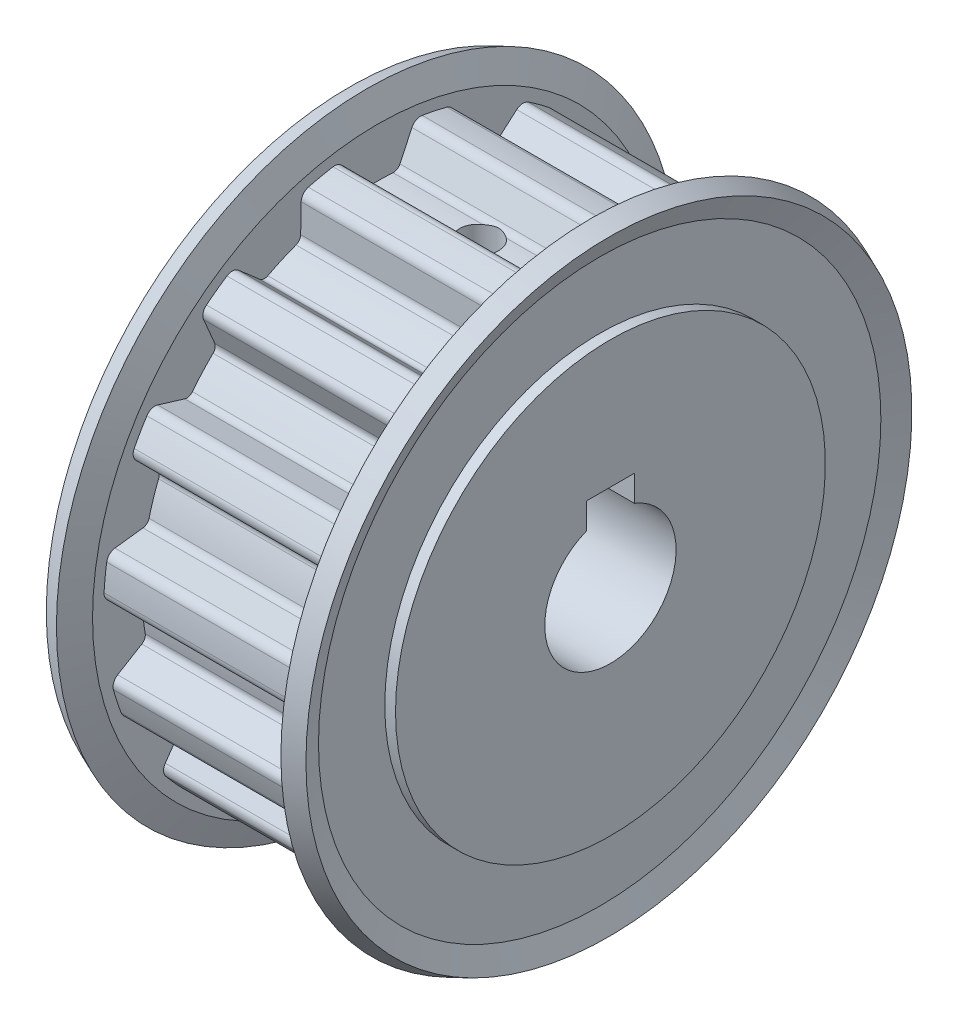
from build123d import *

# Parameters (mm, degrees)
SKETCH2_W           = 15
SKETCH2_H           = 18
CUT_EXTRUDE1_DEPTH  = 17
CUT_EXTRUDE2_DEPTH  = 17
CUT_EXTRUDE3_DEPTH  = 17
CUT_EXTRUDE4_DEPTH  = 17
CUT_EXTRUDE5_DEPTH  = 17
CUT_EXTRUDE6_DEPTH  = 17
CUT_EXTRUDE7_DEPTH  = 17
CUT_EXTRUDE8_DEPTH  = 17
CUT_EXTRUDE9_DEPTH  = 17
CUT_EXTRUDE10_DEPTH = 17
CUT_EXTRUDE11_DEPTH = 17
CUT_EXTRUDE12_DEPTH = 17
CUT_EXTRUDE13_DEPTH = 17
CUT_EXTRUDE14_DEPTH = 17
CUT_EXTRUDE15_DEPTH = 17
SKETCH18_W          = 1.621
SKETCH18_H          = 15.65
SKETCH20_W          = 4
SKETCH20_H          = 7.3
CUT_EXTRUDE16_DEPTH = 37


with BuildPart() as part:
    # Sketch1 → Revolve1 (revolve)
    with BuildSketch(Plane.XY, mode=Mode.PRIVATE) as revolve1_sk:
        Polygon((0, 18), (0, 5.5), (37, 5.5), (37, 6.5), (22, 6.5), (22, 18), (21.1, 18), (21.1, 23.550143875), (21.873308267, 25.376010616), (20.4, 26), (19.5, 23.875), (19.5, 22.95), (2.5, 22.95), (2.5, 23.875), (1.6, 26), (0.126691733, 25.376010616), (0.9, 23.550143875), (0.9, 18), align=None)
    revolve(revolve1_sk.sketch.rotate(Axis((37, 0, 0), (-1, 0, 0)), 270), axis=Axis((37, 0, 0), (-1, 0, 0)))

    # Sketch2 → Cut-Revolve1 (revolve, cut)
    with BuildSketch(Plane.XY, mode=Mode.PRIVATE) as cut_revolve1_sk:
        with Locations((29.5, 9)):
            Rectangle(SKETCH2_W, SKETCH2_H)
    revolve(cut_revolve1_sk.sketch.rotate(Axis((37, 0, 0), (-1, 0, 0)), 270), axis=Axis((37, 0, 0), (-1, 0, 0)), mode=Mode.SUBTRACT)

    # Sketch3 → Cut-Extrude1 (cut)
    with BuildSketch(Plane(origin=(2.5, 0, 0), x_dir=(0, 0, -1), z_dir=(1, 0, 0))):
        with BuildLine():
            Line((-2.873736897, 22.193786317), (-1.875385892, 20.052815678))
            ThreePointArc((-1.875385892, 20.052815678), (-1.63724315, 19.790069862), (-1.292340251, 19.707672533))
            ThreePointArc((-1.292340251, 19.707672533), (0, 19.75), (1.292340251, 19.707672533))
            ThreePointArc((1.292340251, 19.707672533), (1.63724315, 19.790069862), (1.875385892, 20.052815678))
            Line((1.875385892, 20.052815678), (2.873736897, 22.193786317))
            ThreePointArc((2.873736897, 22.193786317), (3.225368058, 22.563195196), (3.72876175, 22.645062062))
            Line((3.72876175, 22.645062062), (3.72876175, 30.6))
            Line((3.72876175, 30.6), (-3.72876175, 30.6))
            Line((-3.72876175, 30.6), (-3.72876175, 22.645062062))
            ThreePointArc((-3.72876175, 22.645062062), (-3.225368058, 22.563195196), (-2.873736897, 22.193786317))
        make_face()
    extrude(amount=CUT_EXTRUDE1_DEPTH, mode=Mode.SUBTRACT)

    # Sketch4 → Cut-Extrude2 (cut)
    with BuildSketch(Plane(origin=(2.5, 0, 0), x_dir=(0, 0, -1), z_dir=(1, 0, 0))):
        with BuildLine():
            Line((6.401736855, 21.443886776), (6.44296467, 19.081946838))
            ThreePointArc((6.44296467, 19.081946838), (6.553650539, 18.745055212), (6.835221003, 18.529496859))
            ThreePointArc((6.835221003, 18.529496859), (8.033048701, 18.042522788), (9.196444135, 17.478212588))
            ThreePointArc((9.196444135, 17.478212588), (9.545042625, 17.413201646), (9.869465197, 17.556370514))
            Line((9.869465197, 17.556370514), (11.652315432, 19.106178579))
            ThreePointArc((11.652315432, 19.106178579), (12.123798609, 19.300629105), (12.616969885, 19.170669548))
            Line((12.616969885, 19.170669548), (15.852534637, 26.437866967))
            Line((15.852534637, 26.437866967), (9.039747919, 29.471115041))
            Line((9.039747919, 29.471115041), (5.804183166, 22.203917622))
            ThreePointArc((5.804183166, 22.203917622), (6.230757933, 21.924379858), (6.401736855, 21.443886776))
        make_face()
    extrude(amount=CUT_EXTRUDE2_DEPTH, mode=Mode.SUBTRACT)

    # Sketch5 → Cut-Extrude3 (cut)
    with BuildSketch(Plane(origin=(2.5, 0, 0), x_dir=(0, 0, -1), z_dir=(1, 0, 0))):
        with BuildLine():
            Line((14.570292147, 16.9861444), (13.647268108, 14.811636036))
            ThreePointArc((13.647268108, 14.811636036), (13.611358512, 14.458850222), (13.78091045, 14.147402842))
            ThreePointArc((13.78091045, 14.147402842), (14.677110303, 13.215329476), (15.510399281, 12.226610902))
            ThreePointArc((15.510399281, 12.226610902), (15.802417515, 12.025432672), (16.157024307, 12.024269392))
            Line((16.157024307, 12.024269392), (18.416102771, 12.714938991))
            ThreePointArc((18.416102771, 12.714938991), (18.92591424, 12.700808901), (19.323589305, 12.381494109))
            Line((19.323589305, 12.381494109), (25.23526027, 17.704386555))
            Line((25.23526027, 17.704386555), (20.245203049, 23.246406554))
            Line((20.245203049, 23.246406554), (14.333532084, 17.923514109))
            ThreePointArc((14.333532084, 17.923514109), (14.609529272, 17.494640065), (14.570292147, 16.9861444))
        make_face()
    extrude(amount=CUT_EXTRUDE3_DEPTH, mode=Mode.SUBTRACT)

    # Sketch6 → Cut-Extrude4 (cut)
    with BuildSketch(Plane(origin=(2.5, 0, 0), x_dir=(0, 0, -1), z_dir=(1, 0, 0))):
        with BuildLine():
            Line((20.219511559, 9.591343343), (18.491834909, 7.980258803))
            ThreePointArc((18.491834909, 7.980258803), (18.315538943, 7.672578674), (18.343755284, 7.319094349))
            ThreePointArc((18.343755284, 7.319094349), (18.783366197, 6.103085639), (19.142465484, 4.860917116))
            ThreePointArc((19.142465484, 4.860917116), (19.327410857, 4.558357141), (19.650887133, 4.413062856))
            Line((19.650887133, 4.413062856), (21.995578636, 4.125170939))
            ThreePointArc((21.995578636, 4.125170939), (22.455567362, 3.904903454), (22.688984585, 3.451445856))
            Line((22.688984585, 3.451445856), (30.254580147, 5.909656868))
            Line((30.254580147, 5.909656868), (27.95007865, 13.002183188))
            Line((27.95007865, 13.002183188), (20.384483088, 10.543972176))
            ThreePointArc((20.384483088, 10.543972176), (20.462180277, 10.039918072), (20.219511559, 9.591343343))
        make_face()
    extrude(amount=CUT_EXTRUDE4_DEPTH, mode=Mode.SUBTRACT)

    # Sketch7 → Cut-Extrude5 (cut)
    with BuildSketch(Plane(origin=(2.5, 0, 0), x_dir=(0, 0, -1), z_dir=(1, 0, 0))):
        with BuildLine():
            Line((22.372593735, 0.538111888), (20.138995461, -0.230977675))
            ThreePointArc((20.138995461, -0.230977675), (19.852796299, -0.44035143), (19.734798181, -0.774752049))
            ThreePointArc((19.734798181, -0.774752049), (19.641807434, -2.06443715), (19.464625501, -3.3452734))
            ThreePointArc((19.464625501, -3.3452734), (19.510519278, -3.696899751), (19.746933051, -3.961202339))
            Line((19.746933051, -3.961202339), (21.771819131, -5.177876643))
            ThreePointArc((21.771819131, -5.177876643), (22.102448885, -5.566195274), (22.131248308, -6.075388741))
            Line((22.131248308, -6.075388741), (30.042608263, -6.906906179))
            Line((30.042608263, -6.906906179), (30.822131734, 0.509764227))
            Line((30.822131734, 0.509764227), (22.910771779, 1.341281665))
            ThreePointArc((22.910771779, 1.341281665), (22.776734418, 0.849203034), (22.372593735, 0.538111888))
        make_face()
    extrude(amount=CUT_EXTRUDE5_DEPTH, mode=Mode.SUBTRACT)

    # Sketch8 → Cut-Extrude6 (cut)
    with BuildSketch(Plane(origin=(2.5, 0, 0), x_dir=(0, 0, -1), z_dir=(1, 0, 0))):
        with BuildLine():
            Line((20.657251205, -8.608164002), (18.303940741, -8.402276014))
            ThreePointArc((18.303940741, -8.402276014), (17.957324818, -8.477140771), (17.713515189, -8.734636779))
            ThreePointArc((17.713515189, -8.734636779), (17.104001725, -9.875), (16.421174938, -10.973035754))
            ThreePointArc((16.421174938, -10.973035754), (16.320081668, -11.312929091), (16.428554849, -11.650539664))
            Line((16.428554849, -11.650539664), (17.783514308, -13.585622315))
            ThreePointArc((17.783514308, -13.585622315), (17.927616201, -14.074848272), (17.746818142, -14.551733431))
            Line((17.746818142, -14.551733431), (24.635996481, -18.5292024))
            Line((24.635996481, -18.5292024), (28.364758231, -12.0707976))
            Line((28.364758231, -12.0707976), (21.475579891, -8.093328631))
            ThreePointArc((21.475579891, -8.093328631), (21.152984259, -8.488346924), (20.657251205, -8.608164002))
        make_face()
    extrude(amount=CUT_EXTRUDE6_DEPTH, mode=Mode.SUBTRACT)

    # Sketch9 → Cut-Extrude7 (cut)
    with BuildSketch(Plane(origin=(2.5, 0, 0), x_dir=(0, 0, -1), z_dir=(1, 0, 0))):
        with BuildLine():
            Line((15.370082277, -16.266010133), (13.303968381, -15.120744499))
            ThreePointArc((13.303968381, -15.120744499), (12.956868739, -15.04815546), (12.629404497, -15.184223459))
            ThreePointArc((12.629404497, -15.184223459), (11.608758733, -15.978085639), (10.538354047, -16.703460539))
            ThreePointArc((10.538354047, -16.703460539), (10.307753674, -16.972850216), (10.269530265, -17.325392839))
            Line((10.269530265, -17.325392839), (10.720278303, -19.644290467))
            ThreePointArc((10.720278303, -19.644290467), (10.652935809, -20.149832138), (10.293801894, -20.511951213))
            Line((10.293801894, -20.511951213), (14.969597097, -26.947631194))
            Line((14.969597097, -26.947631194), (21.002860344, -22.564208862))
            Line((21.002860344, -22.564208862), (16.327065141, -16.128528881))
            ThreePointArc((16.327065141, -16.128528881), (15.871690952, -16.358184583), (15.370082277, -16.266010133))
        make_face()
    extrude(amount=CUT_EXTRUDE7_DEPTH, mode=Mode.SUBTRACT)

    # Sketch10 → Cut-Extrude8 (cut)
    with BuildSketch(Plane(origin=(2.5, 0, 0), x_dir=(0, 0, -1), z_dir=(1, 0, 0))):
        with BuildLine():
            Line((7.42528649, -21.11131534), (6.003619025, -19.224698892))
            ThreePointArc((6.003619025, -19.224698892), (5.716052345, -19.017207362), (5.361555034, -19.008319958))
            ThreePointArc((5.361555034, -19.008319958), (4.106255894, -19.318415114), (2.833356003, -19.545705251))
            ThreePointArc((2.833356003, -19.545705251), (2.513121427, -19.698011345), (2.334810602, -20.004528196))
            Line((2.334810602, -20.004528196), (1.803408788, -22.306282334))
            ThreePointArc((1.803408788, -22.306282334), (1.536266036, -22.740726972), (1.060893783, -22.925466285))
            Line((1.060893783, -22.925466285), (2.71481838, -30.706569742))
            Line((2.71481838, -30.706569742), (10.009377098, -29.156063422))
            Line((10.009377098, -29.156063422), (8.355452501, -21.374959965))
            ThreePointArc((8.355452501, -21.374959965), (7.84603809, -21.399543519), (7.42528649, -21.11131534))
        make_face()
    extrude(amount=CUT_EXTRUDE8_DEPTH, mode=Mode.SUBTRACT)

    # Sketch11 → Cut-Extrude9 (cut)
    with BuildSketch(Plane(origin=(2.5, 0, 0), x_dir=(0, 0, -1), z_dir=(1, 0, 0))):
        with BuildLine():
            Line((-1.803408788, -22.306282334), (-2.334810602, -20.004528196))
            ThreePointArc((-2.334810602, -20.004528196), (-2.513121427, -19.698011345), (-2.833356003, -19.545705251))
            ThreePointArc((-2.833356003, -19.545705251), (-4.106255894, -19.318415114), (-5.361555034, -19.008319958))
            ThreePointArc((-5.361555034, -19.008319958), (-5.716052345, -19.017207362), (-6.003619025, -19.224698892))
            Line((-6.003619025, -19.224698892), (-7.42528649, -21.11131534))
            ThreePointArc((-7.42528649, -21.11131534), (-7.84603809, -21.399543519), (-8.355452501, -21.374959965))
            Line((-8.355452501, -21.374959965), (-10.009377098, -29.156063422))
            Line((-10.009377098, -29.156063422), (-2.71481838, -30.706569742))
            Line((-2.71481838, -30.706569742), (-1.060893783, -22.925466285))
            ThreePointArc((-1.060893783, -22.925466285), (-1.536266036, -22.740726972), (-1.803408788, -22.306282334))
        make_face()
    extrude(amount=CUT_EXTRUDE9_DEPTH, mode=Mode.SUBTRACT)

    # Sketch12 → Cut-Extrude10 (cut)
    with BuildSketch(Plane(origin=(2.5, 0, 0), x_dir=(0, 0, -1), z_dir=(1, 0, 0))):
        with BuildLine():
            Line((-10.720278303, -19.644290467), (-10.269530265, -17.325392839))
            ThreePointArc((-10.269530265, -17.325392839), (-10.307753674, -16.972850216), (-10.538354047, -16.703460539))
            ThreePointArc((-10.538354047, -16.703460539), (-11.608758733, -15.978085639), (-12.629404497, -15.184223459))
            ThreePointArc((-12.629404497, -15.184223459), (-12.956868739, -15.04815546), (-13.303968381, -15.120744499))
            Line((-13.303968381, -15.120744499), (-15.370082277, -16.266010133))
            ThreePointArc((-15.370082277, -16.266010133), (-15.871690952, -16.358184583), (-16.327065141, -16.128528881))
            Line((-16.327065141, -16.128528881), (-21.002860344, -22.564208862))
            Line((-21.002860344, -22.564208862), (-14.969597097, -26.947631194))
            Line((-14.969597097, -26.947631194), (-10.293801894, -20.511951213))
            ThreePointArc((-10.293801894, -20.511951213), (-10.652935809, -20.149832138), (-10.720278303, -19.644290467))
        make_face()
    extrude(amount=CUT_EXTRUDE10_DEPTH, mode=Mode.SUBTRACT)

    # Sketch13 → Cut-Extrude11 (cut)
    with BuildSketch(Plane(origin=(2.5, 0, 0), x_dir=(0, 0, -1), z_dir=(1, 0, 0))):
        with BuildLine():
            Line((-17.783514308, -13.585622315), (-16.428554849, -11.650539664))
            ThreePointArc((-16.428554849, -11.650539664), (-16.320081668, -11.312929091), (-16.421174938, -10.973035754))
            ThreePointArc((-16.421174938, -10.973035754), (-17.104001725, -9.875), (-17.713515189, -8.734636779))
            ThreePointArc((-17.713515189, -8.734636779), (-17.957324818, -8.477140771), (-18.303940741, -8.402276014))
            Line((-18.303940741, -8.402276014), (-20.657251205, -8.608164002))
            ThreePointArc((-20.657251205, -8.608164002), (-21.152984259, -8.488346924), (-21.475579891, -8.093328631))
            Line((-21.475579891, -8.093328631), (-28.364758231, -12.0707976))
            Line((-28.364758231, -12.0707976), (-24.635996481, -18.5292024))
            Line((-24.635996481, -18.5292024), (-17.746818142, -14.551733431))
            ThreePointArc((-17.746818142, -14.551733431), (-17.927616201, -14.074848272), (-17.783514308, -13.585622315))
        make_face()
    extrude(amount=CUT_EXTRUDE11_DEPTH, mode=Mode.SUBTRACT)

    # Sketch14 → Cut-Extrude12 (cut)
    with BuildSketch(Plane(origin=(2.5, 0, 0), x_dir=(0, 0, -1), z_dir=(1, 0, 0))):
        with BuildLine():
            Line((-21.771819131, -5.177876643), (-19.746933051, -3.961202339))
            ThreePointArc((-19.746933051, -3.961202339), (-19.510519278, -3.696899751), (-19.464625501, -3.3452734))
            ThreePointArc((-19.464625501, -3.3452734), (-19.641807434, -2.06443715), (-19.734798181, -0.774752049))
            ThreePointArc((-19.734798181, -0.774752049), (-19.852796299, -0.44035143), (-20.138995461, -0.230977675))
            Line((-20.138995461, -0.230977675), (-22.372593735, 0.538111888))
            ThreePointArc((-22.372593735, 0.538111888), (-22.776734418, 0.849203034), (-22.910771779, 1.341281665))
            Line((-22.910771779, 1.341281665), (-30.822131734, 0.509764227))
            Line((-30.822131734, 0.509764227), (-30.042608263, -6.906906179))
            Line((-30.042608263, -6.906906179), (-22.131248308, -6.075388741))
            ThreePointArc((-22.131248308, -6.075388741), (-22.102448885, -5.566195274), (-21.771819131, -5.177876643))
        make_face()
    extrude(amount=CUT_EXTRUDE12_DEPTH, mode=Mode.SUBTRACT)

    # Sketch15 → Cut-Extrude13 (cut)
    with BuildSketch(Plane(origin=(2.5, 0, 0), x_dir=(0, 0, -1), z_dir=(1, 0, 0))):
        with BuildLine():
            Line((-21.995578636, 4.125170939), (-19.650887133, 4.413062856))
            ThreePointArc((-19.650887133, 4.413062856), (-19.327410857, 4.558357141), (-19.142465484, 4.860917116))
            ThreePointArc((-19.142465484, 4.860917116), (-18.783366197, 6.103085639), (-18.343755284, 7.319094349))
            ThreePointArc((-18.343755284, 7.319094349), (-18.315538943, 7.672578674), (-18.491834909, 7.980258803))
            Line((-18.491834909, 7.980258803), (-20.219511559, 9.591343343))
            ThreePointArc((-20.219511559, 9.591343343), (-20.462180277, 10.039918072), (-20.384483088, 10.543972176))
            Line((-20.384483088, 10.543972176), (-27.95007865, 13.002183188))
            Line((-27.95007865, 13.002183188), (-30.254580147, 5.909656868))
            Line((-30.254580147, 5.909656868), (-22.688984585, 3.451445856))
            ThreePointArc((-22.688984585, 3.451445856), (-22.455567362, 3.904903454), (-21.995578636, 4.125170939))
        make_face()
    extrude(amount=CUT_EXTRUDE13_DEPTH, mode=Mode.SUBTRACT)

    # Sketch16 → Cut-Extrude14 (cut)
    with BuildSketch(Plane(origin=(2.5, 0, 0), x_dir=(0, 0, -1), z_dir=(1, 0, 0))):
        with BuildLine():
            Line((-18.416102771, 12.714938991), (-16.157024307, 12.024269392))
            ThreePointArc((-16.157024307, 12.024269392), (-15.802417515, 12.025432672), (-15.510399281, 12.226610902))
            ThreePointArc((-15.510399281, 12.226610902), (-14.677110303, 13.215329476), (-13.78091045, 14.147402842))
            ThreePointArc((-13.78091045, 14.147402842), (-13.611358512, 14.458850222), (-13.647268108, 14.811636036))
            Line((-13.647268108, 14.811636036), (-14.570292147, 16.9861444))
            ThreePointArc((-14.570292147, 16.9861444), (-14.609529272, 17.494640065), (-14.333532084, 17.923514109))
            Line((-14.333532084, 17.923514109), (-20.245203049, 23.246406554))
            Line((-20.245203049, 23.246406554), (-25.23526027, 17.704386555))
            Line((-25.23526027, 17.704386555), (-19.323589305, 12.381494109))
            ThreePointArc((-19.323589305, 12.381494109), (-18.92591424, 12.700808901), (-18.416102771, 12.714938991))
        make_face()
    extrude(amount=CUT_EXTRUDE14_DEPTH, mode=Mode.SUBTRACT)

    # Sketch17 → Cut-Extrude15 (cut)
    with BuildSketch(Plane(origin=(2.5, 0, 0), x_dir=(0, 0, -1), z_dir=(1, 0, 0))):
        with BuildLine():
            Line((-11.652315432, 19.106178579), (-9.869465197, 17.556370514))
            ThreePointArc((-9.869465197, 17.556370514), (-9.545042625, 17.413201646), (-9.196444135, 17.478212588))
            ThreePointArc((-9.196444135, 17.478212588), (-8.033048701, 18.042522788), (-6.835221003, 18.529496859))
            ThreePointArc((-6.835221003, 18.529496859), (-6.553650539, 18.745055212), (-6.44296467, 19.081946838))
            Line((-6.44296467, 19.081946838), (-6.401736855, 21.443886776))
            ThreePointArc((-6.401736855, 21.443886776), (-6.230757933, 21.924379858), (-5.804183166, 22.203917622))
            Line((-5.804183166, 22.203917622), (-9.039747919, 29.471115041))
            Line((-9.039747919, 29.471115041), (-15.852534637, 26.437866967))
            Line((-15.852534637, 26.437866967), (-12.616969885, 19.170669548))
            ThreePointArc((-12.616969885, 19.170669548), (-12.123798609, 19.300629105), (-11.652315432, 19.106178579))
        make_face()
    extrude(amount=CUT_EXTRUDE15_DEPTH, mode=Mode.SUBTRACT)

    # Sketch18 → Cut-Revolve2 (revolve, cut)
    with BuildSketch(Plane(origin=(11, 0, 0), x_dir=(0, 0, -1), z_dir=(1, 0, 0)), mode=Mode.PRIVATE) as cut_revolve2_sk:
        with Locations((0.8105, 15.125)):
            Rectangle(SKETCH18_W, SKETCH18_H)
    revolve(cut_revolve2_sk.sketch.rotate(Axis((11, 7.3, 0), (0, 1, 0)), 180), axis=Axis((11, 7.3, 0), (0, 1, 0)), mode=Mode.SUBTRACT)

    # Sketch19 → Cut-Revolve3 (revolve, cut)
    with BuildSketch(Plane(origin=(11, 0, 0), x_dir=(0, 0, -1), z_dir=(1, 0, 0)), mode=Mode.PRIVATE) as cut_revolve3_sk:
        Polygon((19.875283017, -11.475), (19.064783017, -12.87882718), (3.626559837, -3.965564871), (4.437059837, -2.561737691), align=None)
    revolve(cut_revolve3_sk.sketch.rotate(Axis((11, -2.561737691, -4.437059837), (0, -0.49999999999999656, -0.8660254037844407)), 180), axis=Axis((11, -2.561737691, -4.437059837), (0, -0.49999999999999656, -0.8660254037844407)), mode=Mode.SUBTRACT)

    # Sketch20 → Cut-Extrude16 (cut)
    with BuildSketch(Plane(origin=(0, 0, 0), x_dir=(0, 0, -1), z_dir=(1, 0, 0))):
        with Locations((0, 3.65)):
            Rectangle(SKETCH20_W, SKETCH20_H)
    extrude(amount=CUT_EXTRUDE16_DEPTH, mode=Mode.SUBTRACT)


solid = part.part
